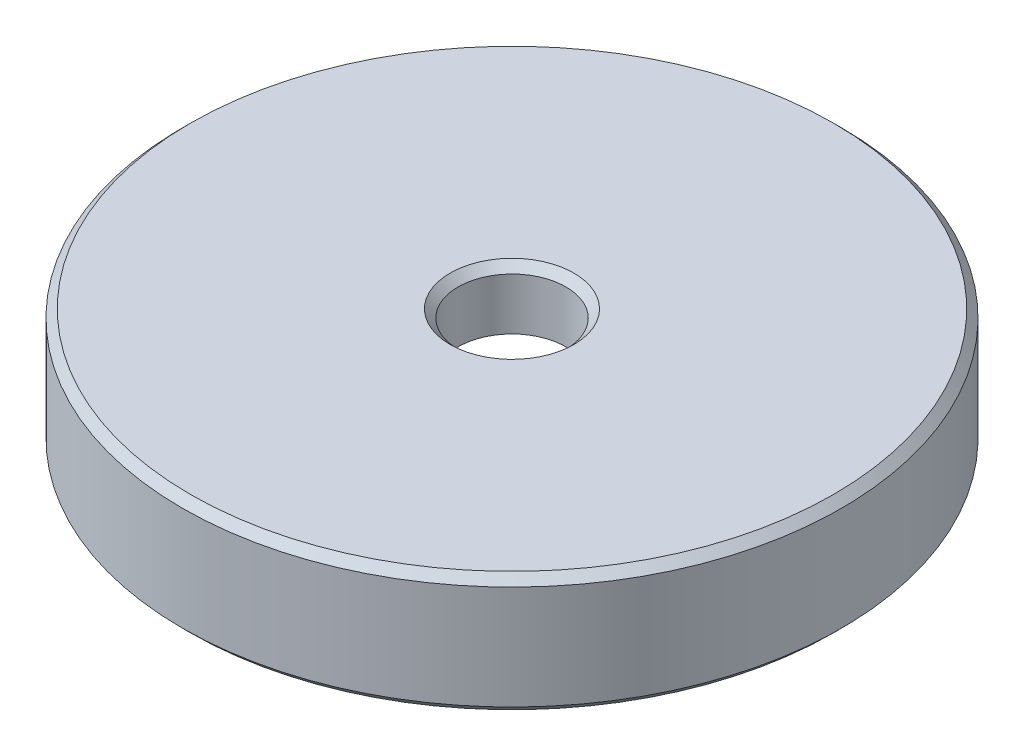
from build123d import *

# Parameters (mm, degrees)
SKETCH1_R           = 16.5
SKETCH1_R_2         = 2.7
BOSS_EXTRUDE1_DEPTH = 3
BOSS_EXTRUDE2_START = -3
SKETCH1_3_R         = 16.5
SKETCH1_3_R_2       = 14.7
BOSS_EXTRUDE2_DEPTH = 3
CHAMFER1_SIZE       = 0.4


with BuildPart() as part:
    # Sketch1 → Boss-Extrude1 (new body)
    with BuildSketch(Plane(origin=(0, 0, 0), x_dir=(1, 0, 0), z_dir=(0, 1, 0))):
        Circle(SKETCH1_R)
        Circle(SKETCH1_R_2, mode=Mode.SUBTRACT)
    extrude(amount=BOSS_EXTRUDE1_DEPTH)

    # Sketch1<3> → Boss-Extrude2 (add)
    with BuildSketch(Plane(origin=(0, 0, 0), x_dir=(1, 0, 0), z_dir=(0, 1, 0)).offset(BOSS_EXTRUDE2_START)):
        Circle(SKETCH1_3_R)
        Circle(SKETCH1_3_R_2, mode=Mode.SUBTRACT)
    extrude(amount=BOSS_EXTRUDE2_DEPTH)

    # Chamfer1
    chamfer1_edges = [part.edges().sort_by_distance(p)[0] for p in [
        (-14.7, -3, 0),
        (-16.5, -3, 0),
        (-16.5, 3, 0),
        (-2.7, 3, 0),
    ]]
    chamfer(chamfer1_edges, length=CHAMFER1_SIZE)


solid = part.part
